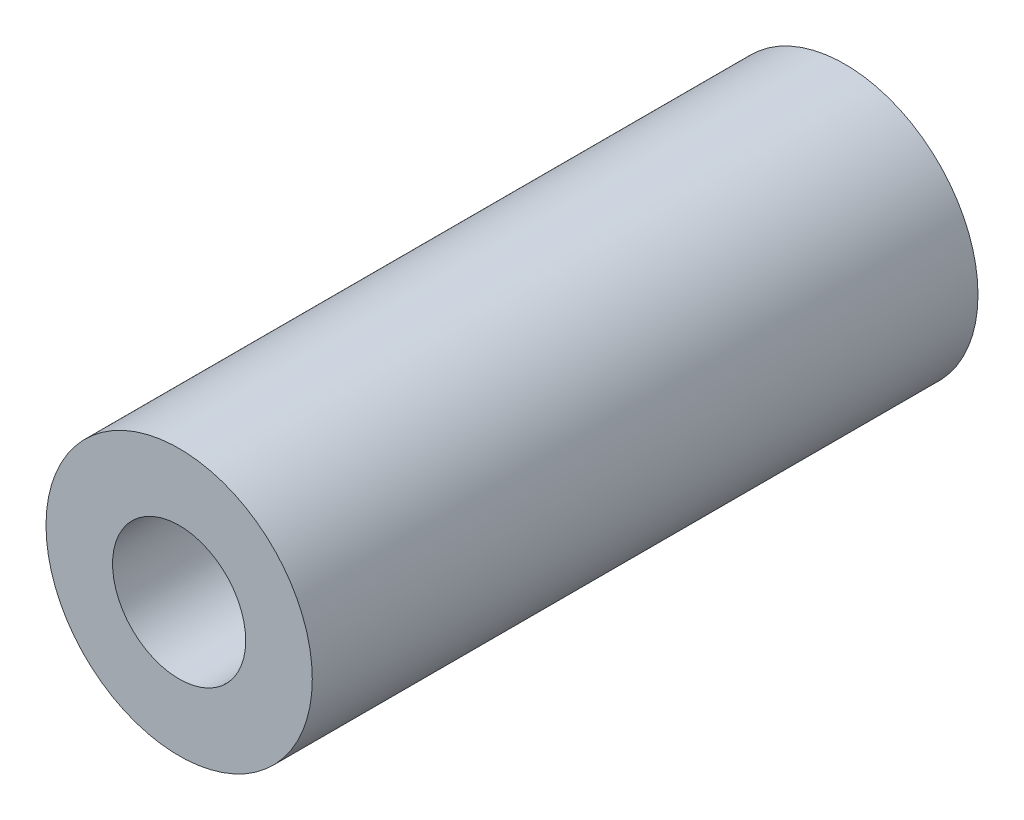
from build123d import *

# Parameters (mm, degrees)
SKETCH1_R           = 3.175
SKETCH1_R_2         = 1.5875
BOSS_EXTRUDE1_DEPTH = 15.875


with BuildPart() as part:
    # Sketch1 → Boss-Extrude1 (new body)
    with BuildSketch(Plane.XY):
        Circle(SKETCH1_R)
        Circle(SKETCH1_R_2, mode=Mode.SUBTRACT)
    extrude(amount=BOSS_EXTRUDE1_DEPTH)


solid = part.part
